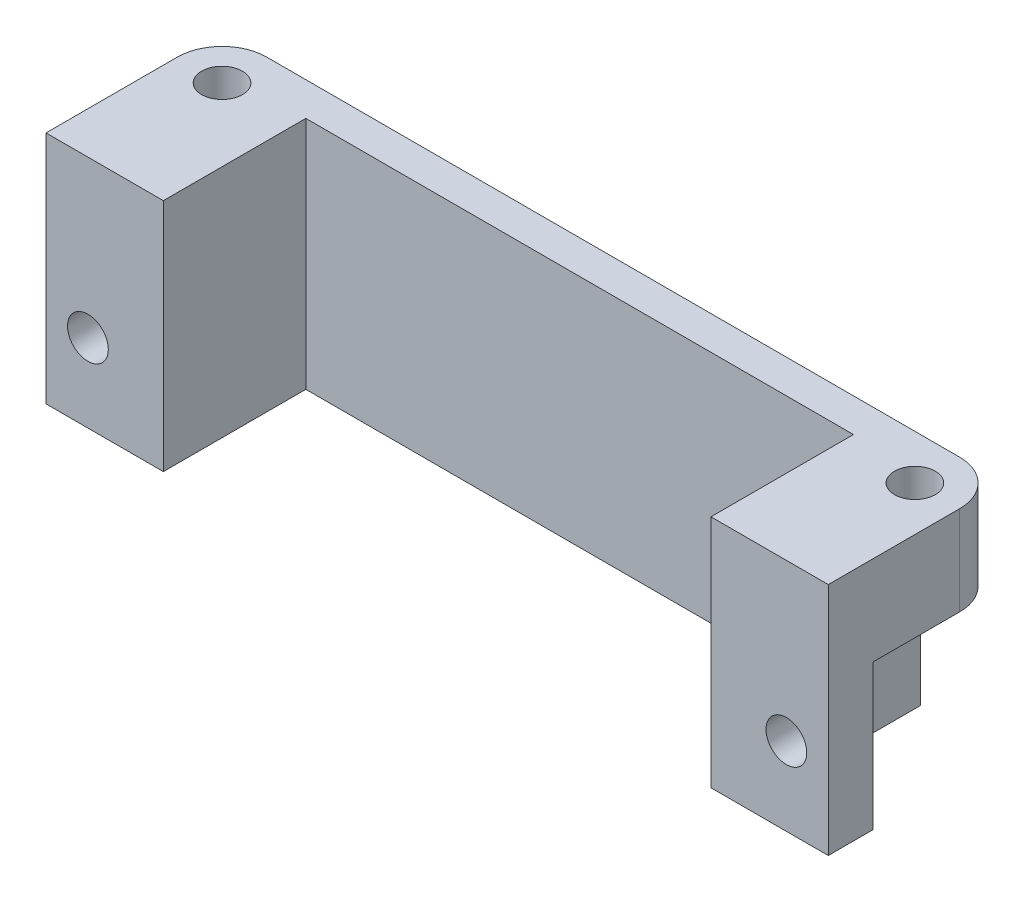
from build123d import *

# Parameters (mm, degrees)
BOSS_EXTRUDE1_DEPTH  = 21
SKETCH2_R            = 1.825
CUT_EXTRUDE1_DEPTH   = 4
SKETCH3_W            = 7.5
SKETCH3_H            = 11.75
CUT_EXTRUDE2_DEPTH   = 13
FILLET1_R            = 4
SKETCH5_R            = 1.825
CUT_EXTRUDE3_DEPTH   = 41.522370365
FILLET1_OF_MIRROR1_R = 4


with BuildPart() as part:
    # Sketch1 → Boss-Extrude1 (new body)
    with BuildSketch(Plane(origin=(0, 0, 0), x_dir=(1, 0, 0), z_dir=(0, 1, 0))):
        Polygon((-24.5, 0), (-24.5, 12.75), (0, 12.75), (0, 15.75), (-35, 15.75), (-35, 0), align=None)
    boss_extrude1 = extrude(amount=BOSS_EXTRUDE1_DEPTH)

    # Sketch2 → Cut-Extrude1 (cut)
    with BuildSketch(Plane.XY):
        with Locations((-31.25, 7)):
            Circle(SKETCH2_R)
    cut_extrude1 = extrude(amount=-CUT_EXTRUDE1_DEPTH, mode=Mode.SUBTRACT)

    # Sketch3 → Cut-Extrude2 (cut)
    with BuildSketch(Plane.XZ):
        with Locations((-31.25, -9.875)):
            Rectangle(SKETCH3_W, SKETCH3_H)
    cut_extrude2 = extrude(amount=-CUT_EXTRUDE2_DEPTH, mode=Mode.SUBTRACT)

    # Fillet1
    fillet1_edges = [part.edges().sort_by_distance(p)[0] for p in [
        (-35, 17, -15.75),
    ]]
    fillet(fillet1_edges, radius=FILLET1_R)

    # Sketch5 → Cut-Extrude3 (cut, through all)
    with BuildSketch(Plane.XZ.offset(-13)):
        with Locations(Location((-31, -11.75, 0), (0, 0, 270))):
            Circle(SKETCH5_R)
    cut_extrude3 = extrude(amount=-CUT_EXTRUDE3_DEPTH, mode=Mode.SUBTRACT)

    # Mirror1: Boss-Extrude1, Cut-Extrude1, Cut-Extrude2, Cut-Extrude3 across plane
    add(boss_extrude1.mirror(Plane(origin=(0, 21, 0), x_dir=(0, 0, 1), z_dir=(-1, 0, 0))))
    add(cut_extrude1.mirror(Plane(origin=(0, 21, 0), x_dir=(0, 0, 1), z_dir=(-1, 0, 0))), mode=Mode.SUBTRACT)
    add(cut_extrude2.mirror(Plane(origin=(0, 21, 0), x_dir=(0, 0, 1), z_dir=(-1, 0, 0))), mode=Mode.SUBTRACT)
    add(cut_extrude3.mirror(Plane(origin=(0, 21, 0), x_dir=(0, 0, 1), z_dir=(-1, 0, 0))), mode=Mode.SUBTRACT)

    # Fillet1 of Mirror1
    fillet1_of_mirror1_edges = [part.edges().sort_by_distance(p)[0] for p in [
        (35, 17, -15.75),
    ]]
    fillet(fillet1_of_mirror1_edges, radius=FILLET1_OF_MIRROR1_R)


solid = part.part
